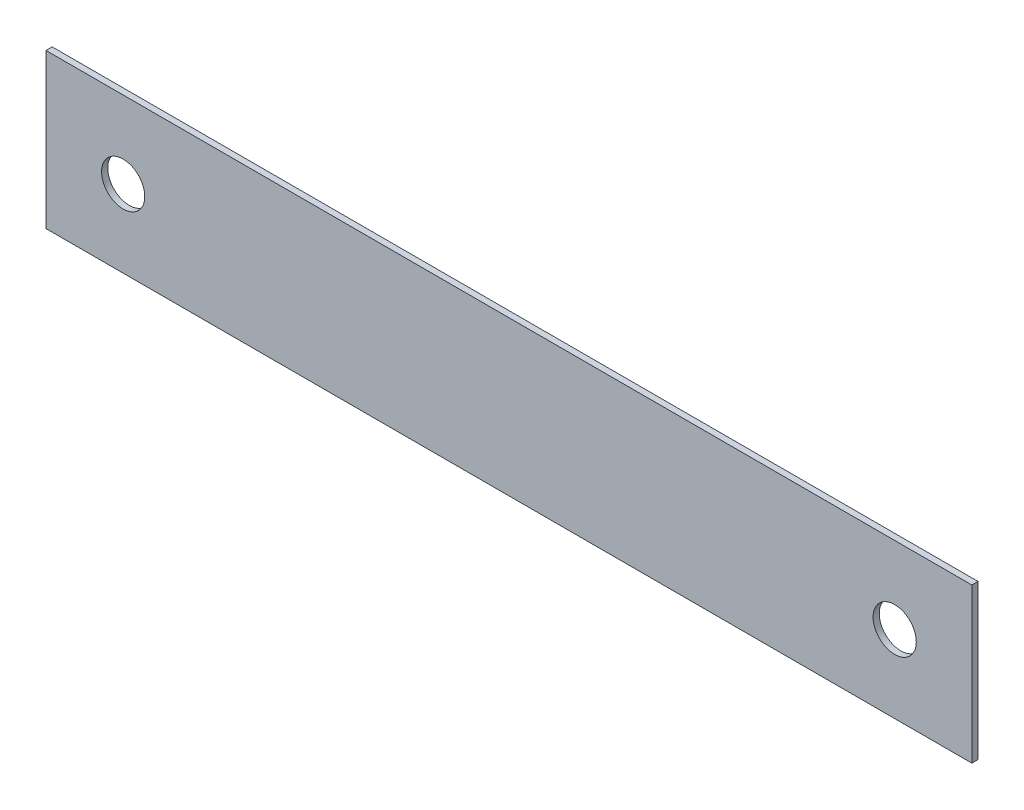
from build123d import *

# Parameters (mm, degrees)
CROQUIS1_W              = 150
CROQUIS1_H              = 25
CROQUIS1_R              = 3.5
SALIENTE_EXTRUIR1_DEPTH = 1


with BuildPart() as part:
    # Croquis1 → Saliente-Extruir1 (new body)
    with BuildSketch(Plane.XY):
        with Locations((75, 12.5)):
            Rectangle(CROQUIS1_W, CROQUIS1_H)
        with Locations((12.5, 12.5)):
            Circle(CROQUIS1_R, mode=Mode.SUBTRACT)
        with Locations((137.5, 12.5)):
            Circle(CROQUIS1_R, mode=Mode.SUBTRACT)
    extrude(amount=SALIENTE_EXTRUIR1_DEPTH)


solid = part.part
